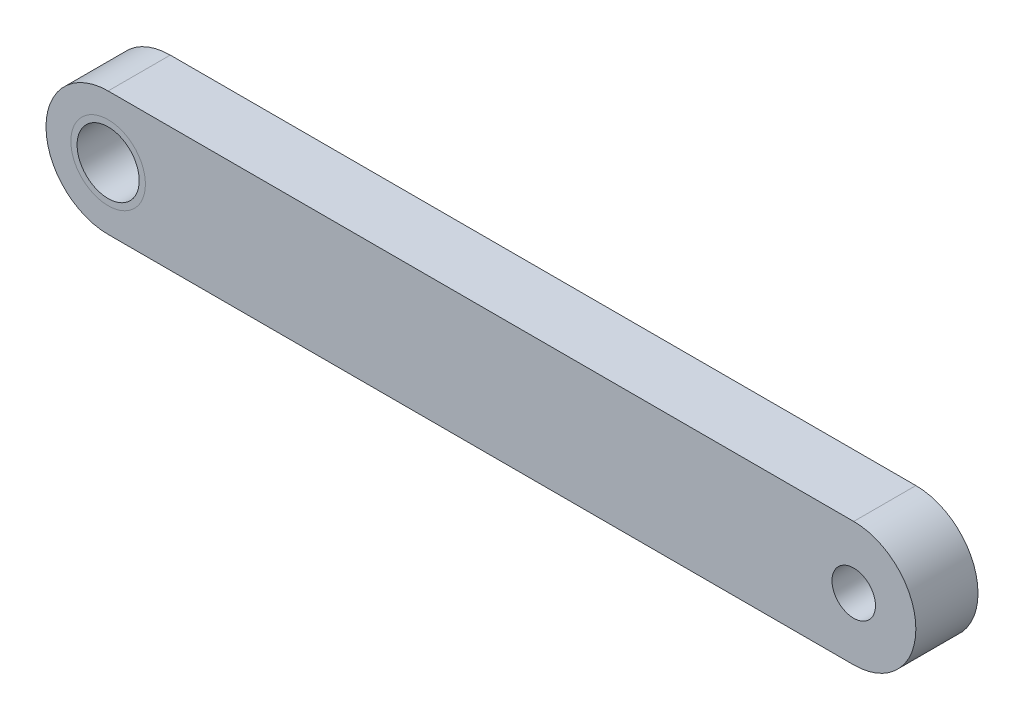
from build123d import *

# Parameters (mm, degrees)
SKETCH_1_R          = 3
EXTRUDE_1_DEPTH     = 2.5
EXTRUDE_START       = -5
SKETCH_2_R          = 3
EXTRUDE_2_DEPTH     = 5
SKETCH_3_R          = 1.75
CUT_EXTRUDE_1_DEPTH = 5
SKETCH_4_R          = 3
CUT_EXTRUDE_2_DEPTH = 10
SKETCH_5_R          = 3
EXTRUDE_4_DEPTH     = 5
SKETCH_6_R          = 1.75
CUT_EXTRUDE_3_DEPTH = 5
SKETCH_7_R          = 3
EXTRUDE_5_DEPTH     = 5
SKETCH_8_R          = 2.5
CUT_EXTRUDE_4_DEPTH = 5


with BuildPart() as part:
    # 草图1 → 凸台-拉伸1 (new, symmetric)
    with BuildSketch(Plane.XY):
        with BuildLine():
            Line((-69.937695792, 26.038617485), (-9.937695792, 26.038617485))
            ThreePointArc((-9.937695792, 26.038617485), (-4.937695792, 21.038617485), (-9.937695792, 16.038617485))
            Line((-9.937695792, 16.038617485), (-69.937695792, 16.038617485))
            ThreePointArc((-69.937695792, 16.038617485), (-74.937695792, 21.038617485), (-69.937695792, 26.038617485))
        make_face()
        with Locations((-69.937695792, 21.038617485)):
            Circle(SKETCH_1_R, mode=Mode.SUBTRACT)
        with Locations((-9.937695792, 21.038617485)):
            Circle(SKETCH_1_R, mode=Mode.SUBTRACT)
    extrude(amount=EXTRUDE_1_DEPTH, both=True)

    # 草图2 → 凸台-拉伸2 (add)
    with BuildSketch(Plane.XY.offset(2.5).offset(EXTRUDE_START)):
        with Locations((-69.937695792, 21.038617485)):
            Circle(SKETCH_2_R)
    extrude(amount=EXTRUDE_2_DEPTH)

    # 草图3 → 切除-拉伸1 (cut)
    with BuildSketch(Plane.XY.offset(2.5)):
        with Locations((-69.937695792, 21.038617485)):
            Circle(SKETCH_3_R)
    extrude(amount=-CUT_EXTRUDE_1_DEPTH, mode=Mode.SUBTRACT)

    # 草图4 → 切除-拉伸2 (cut)
    with BuildSketch(Plane.XY.offset(2.5)):
        with Locations((-69.937695792, 21.038617485)):
            Circle(SKETCH_4_R)
    extrude(amount=-CUT_EXTRUDE_2_DEPTH, mode=Mode.SUBTRACT)

    # 草图5 → 凸台-拉伸4 (add)
    with BuildSketch(Plane.XY.offset(2.5).offset(EXTRUDE_START)):
        with Locations((-9.937695792, 21.038617485)):
            Circle(SKETCH_5_R)
    extrude(amount=EXTRUDE_4_DEPTH)

    # 草图6 → 切除-拉伸3 (cut)
    with BuildSketch(Plane.XY.offset(2.5)):
        with Locations((-9.937695792, 21.038617485)):
            Circle(SKETCH_6_R)
    extrude(amount=-CUT_EXTRUDE_3_DEPTH, mode=Mode.SUBTRACT)


with BuildPart() as body_2:
    # 草图7 → 凸台-拉伸5 (new body)
    with BuildSketch(Plane.XY.offset(2.5)):
        with Locations((-69.937695792, 21.038617485)):
            Circle(SKETCH_7_R)
    extrude(amount=-EXTRUDE_5_DEPTH)

    # 草图8 → 切除-拉伸4 (cut)
    with BuildSketch(Plane.XY.offset(2.5)):
        with Locations((-69.937695792, 21.038617485)):
            Circle(SKETCH_8_R)
    extrude(amount=-CUT_EXTRUDE_4_DEPTH, mode=Mode.SUBTRACT)


solid = Compound([part.part, body_2.part])
